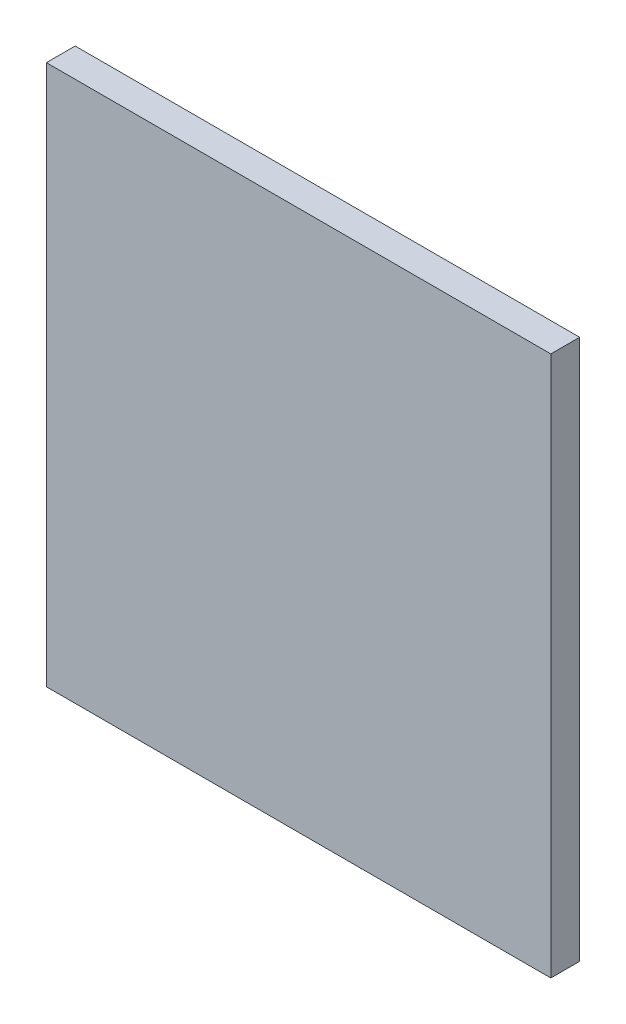
from build123d import *

# Parameters (mm, degrees)
SKETCH1_W     = 70
SKETCH1_H     = 75
PROFILE_DEPTH = 4


with BuildPart() as part:
    # Sketch1 → Profile (new body)
    with BuildSketch(Plane.XY):
        with Locations((35, 37.5)):
            Rectangle(SKETCH1_W, SKETCH1_H)
    extrude(amount=PROFILE_DEPTH)


solid = part.part
